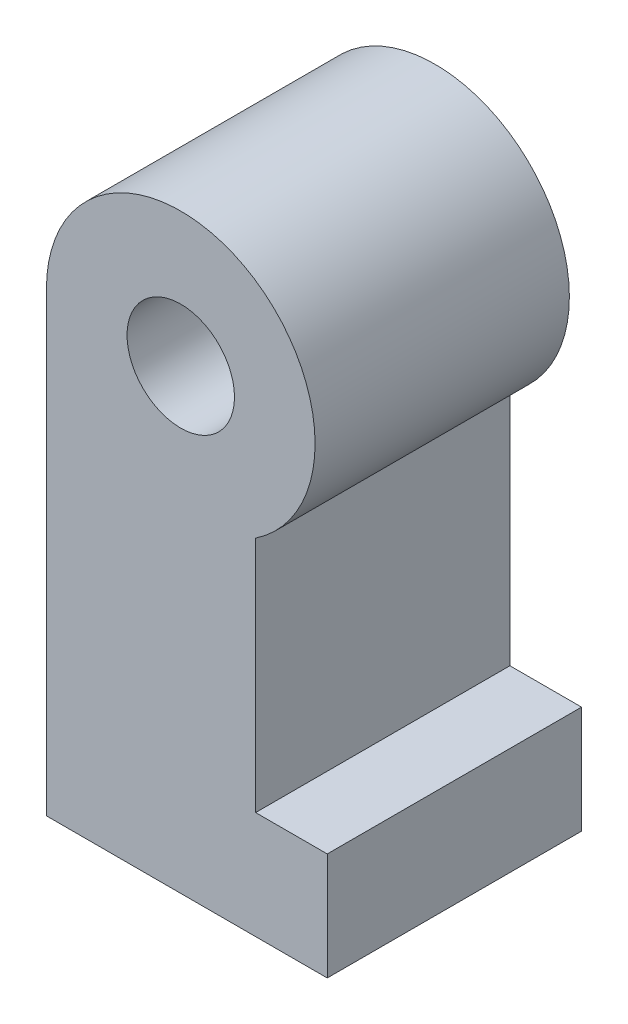
from build123d import *

# Parameters (mm, degrees)
BOSS_EXTRUDE1_DEPTH = 180.34
SKETCH2_R           = 38.1
CUT_EXTRUDE1_DEPTH  = 101.6
SKETCH3_R           = 61.722
CUT_EXTRUDE2_DEPTH  = 50.8
SKETCH4_R           = 61.722
CUT_EXTRUDE8_DEPTH  = 50.8


with BuildPart() as part:
    # Sketch1 → Boss-Extrude1 (new body)
    with BuildSketch(Plane.XY):
        with BuildLine():
            Line((-95.25, 0), (-95.25, -323.85))
            Line((-95.25, -323.85), (103.886, -323.85))
            Line((103.886, -323.85), (103.886, -247.65))
            Line((103.886, -247.65), (53.086, -247.65))
            Line((53.086, -247.65), (53.086, -79.08501188))
            ThreePointArc((53.086, -79.08501188), (44.811388062, 84.050591907), (-95.25, 0))
        make_face()
    extrude(amount=BOSS_EXTRUDE1_DEPTH)

    # Sketch2 → Cut-Extrude1 (cut)
    with BuildSketch(Plane.XY.offset(180.34)):
        Circle(SKETCH2_R)
    extrude(amount=-CUT_EXTRUDE1_DEPTH, mode=Mode.SUBTRACT)

    # Sketch3 → Cut-Extrude2 (cut)
    with BuildSketch(Plane.XZ.offset(323.85)):
        with Locations(Location((0, 90.17, 0), (0, 0, 270))):
            Circle(SKETCH3_R)
    extrude(amount=-CUT_EXTRUDE2_DEPTH, mode=Mode.SUBTRACT)

    # Sketch4 → Cut-Extrude8 (cut)
    with BuildSketch(Plane.ZY.offset(95.25)):
        with Locations(Location((90.17, -209.55, 0), (0, 0, 270))):
            Circle(SKETCH4_R)
        with Locations(Location((90.17, -9.906, 0), (0, 0, 270))):
            Circle(SKETCH4_R)
    extrude(amount=-CUT_EXTRUDE8_DEPTH, mode=Mode.SUBTRACT)


solid = part.part
